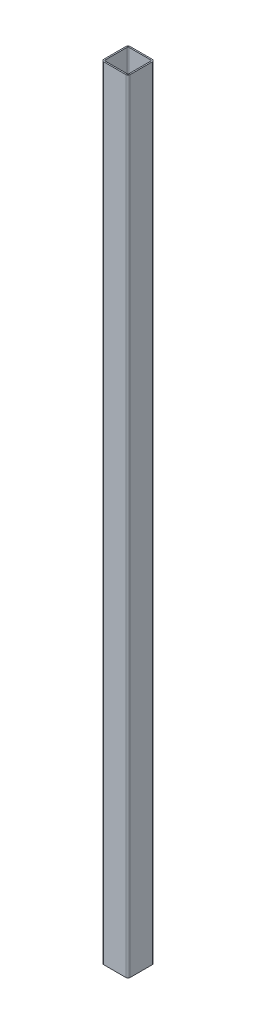
from build123d import *

# Parameters (mm, degrees)
EXTRUDE_THIN1_DEPTH      = 630
EXTRUDE_THIN1_DEPTH_BACK = 1143


with BuildPart() as part:
    # Sketch1 → Extrude-Thin1 (new, two sides: drawn at the far end of the back side and taken through both)
    with BuildSketch(Plane(origin=(0, 0, 0), x_dir=(1, 0, 0), z_dir=(0, 1, 0)).offset(-EXTRUDE_THIN1_DEPTH_BACK)):
        with BuildLine():
            Line((-30, -25), (-30, 25))
            ThreePointArc((-30, 25), (-28.535533906, 28.535533906), (-25, 30))
            Line((-25, 30), (25, 30))
            ThreePointArc((25, 30), (28.535533906, 28.535533906), (30, 25))
            Line((30, 25), (30, -25))
            ThreePointArc((30, -25), (28.535533906, -28.535533906), (25, -30))
            Line((25, -30), (-25, -30))
            ThreePointArc((-25, -30), (-28.535533906, -28.535533906), (-30, -25))
        make_face()
        with BuildLine():
            Line((-27, -25), (-27, 25))
            ThreePointArc((-27, 25), (-26.414213562, 26.414213562), (-25, 27))
            Line((-25, 27), (25, 27))
            ThreePointArc((25, 27), (26.414213562, 26.414213562), (27, 25))
            Line((27, 25), (27, -25))
            ThreePointArc((27, -25), (26.414213562, -26.414213562), (25, -27))
            Line((25, -27), (-25, -27))
            ThreePointArc((-25, -27), (-26.414213562, -26.414213562), (-27, -25))
        make_face(mode=Mode.SUBTRACT)
    extrude(amount=EXTRUDE_THIN1_DEPTH + EXTRUDE_THIN1_DEPTH_BACK)


solid = part.part
